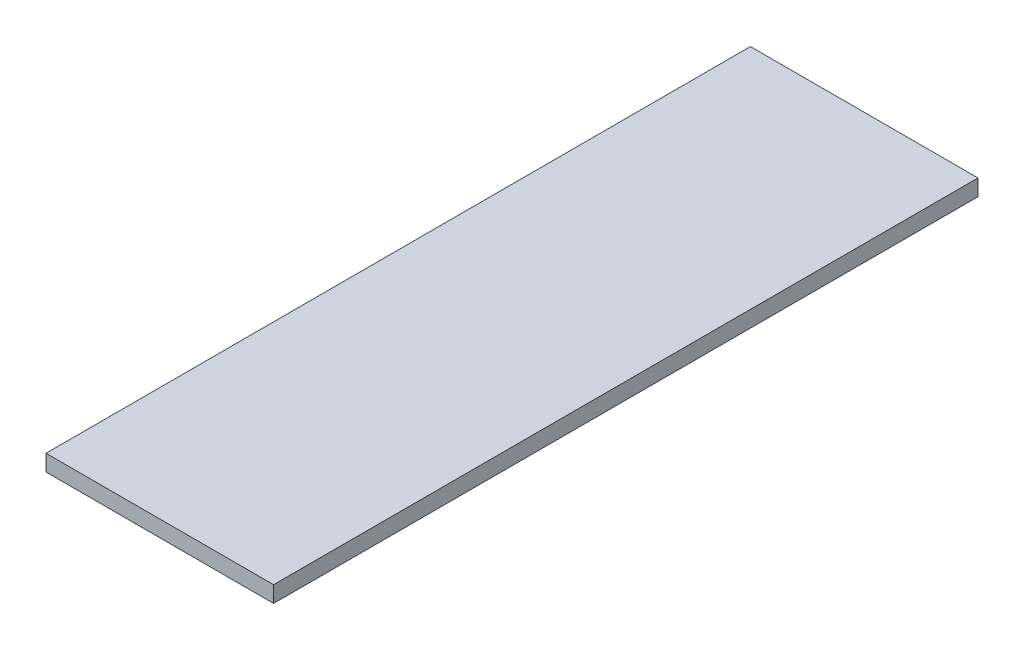
from build123d import *

# Parameters (mm, degrees)
SKETCH1_W           = 21
SKETCH1_H           = 65
BOSS_EXTRUDE1_DEPTH = 1.5


with BuildPart() as part:
    # Sketch1 → Boss-Extrude1 (new body)
    with BuildSketch(Plane(origin=(0, 0, 0), x_dir=(1, 0, 0), z_dir=(0, 1, 0))):
        Rectangle(SKETCH1_W, SKETCH1_H)
    extrude(amount=BOSS_EXTRUDE1_DEPTH)


solid = part.part
